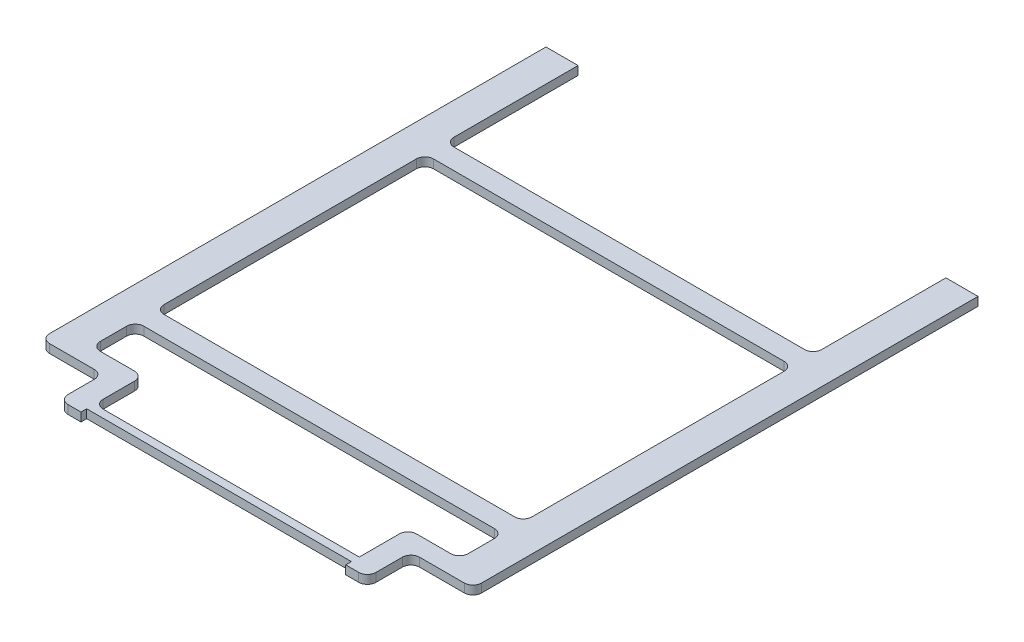
from build123d import *

# Parameters (mm, degrees)
SKETCH_1_W      = 42.566219829
SKETCH_1_H      = 4.687941776
SKETCH_1_W_2    = 6.910818326
SKETCH_1_H_2    = 4.318604229
SKETCH_1_W_3    = 5.015201163
SKETCH_1_H_3    = 4.736132542
SKETCH_1_W_4    = 61.28040068
SKETCH_1_H_4    = 1.827886604
EXTRUDE_1_DEPTH = 2
FILLET_1_R      = 2
FILLET_2_R      = 2


with BuildPart() as part:
    # 草图1 → 凸台-拉伸1 (new body)
    with BuildSketch(Plane(origin=(0, 0, 0), x_dir=(1, 0, 0), z_dir=(0, 1, 0))):
        Polygon((-50.243578821, 63.5), (-50.243578821, -53.4162), (-42.80979865, -53.4162), (-42.80979865, -49.097595771), (-42.80979865, -39.017252134), (-42.80979865, -34.329310358), (-42.80979865, 28.04266881), (-42.80979865, 32.778801352), (-42.80979865, 63.5), align=None)
        with Locations((-21.526688736, -36.673281246)):
            Rectangle(SKETCH_1_W, SKETCH_1_H)
        with Locations((-39.354389487, -51.256897886)):
            Rectangle(SKETCH_1_W_2, SKETCH_1_H_2)
        with Locations((-33.391379742, -51.256897886)):
            Rectangle(SKETCH_1_W_3, SKETCH_1_H_2)
        Polygon((-35.898980324, -53.4162), (-35.898980324, -63.5), (-30.883779161, -63.5), (-30.883779161, -62.190126209), (-30.883779161, -60.362239605), (-30.883779161, -53.4162), align=None)
        with Locations((21.039531094, -36.673281246)):
            Rectangle(SKETCH_1_W, SKETCH_1_H)
        Polygon((30.396621519, -62.190126209), (30.396621519, -63.5), (35.411822682, -63.5), (35.411822682, -53.4162), (30.396621519, -53.4162), (30.396621519, -60.362239605), align=None)
        with Locations((38.867231845, -51.256897886)):
            Rectangle(SKETCH_1_W_2, SKETCH_1_H_2)
        with Locations((32.904222101, -51.256897886)):
            Rectangle(SKETCH_1_W_3, SKETCH_1_H_2)
        Polygon((49.756421179, 63.5), (42.322641008, 63.5), (42.322641008, 32.778801352), (42.322641008, 28.04266881), (42.322641008, -34.329310358), (42.322641008, -39.017252134), (42.322641008, -49.097595771), (42.322641008, -53.4162), (49.756421179, -53.4162), align=None)
        with Locations((21.039531094, 30.410735081)):
            Rectangle(SKETCH_1_W, SKETCH_1_H_3)
        with Locations((-21.526688736, 30.410735081)):
            Rectangle(SKETCH_1_W, SKETCH_1_H_3)
        with Locations((-0.243578821, -61.276182907)):
            Rectangle(SKETCH_1_W_4, SKETCH_1_H_4)
    extrude(amount=EXTRUDE_1_DEPTH)

    # 圆角1
    fillet_1_edges = [part.edges().sort_by_distance(p)[0] for p in [
        (42.322641008, 1, -28.04266881),
        (-42.80979865, 1, -28.04266881),
        (-42.80979865, 1, 34.329310358),
        (42.322641008, 1, 34.329310358),
        (-42.80979865, 1, 39.017252134),
        (-42.80979865, 1, 49.097595771),
        (-30.883779161, 1, 49.097595771),
        (-30.883779161, 1, 60.362239605),
        (30.396621519, 1, 49.097595771),
        (42.322641008, 1, 49.097595771),
        (42.322641008, 1, 39.017252134),
        (-42.80979865, 1, -32.778801352),
        (42.322641008, 1, -32.778801352),
        (35.411822682, 1, 53.4162),
    ]]
    fillet(fillet_1_edges, radius=FILLET_1_R)

    # 圆角2
    fillet_2_edges = [part.edges().sort_by_distance(p)[0] for p in [
        (-35.898980324, 1, 63.5),
        (-35.898980324, 1, 53.4162),
        (-50.243578821, 1, 53.4162),
        (49.756421179, 1, 53.4162),
        (35.411822682, 1, 63.5),
    ]]
    fillet(fillet_2_edges, radius=FILLET_2_R)


solid = part.part
